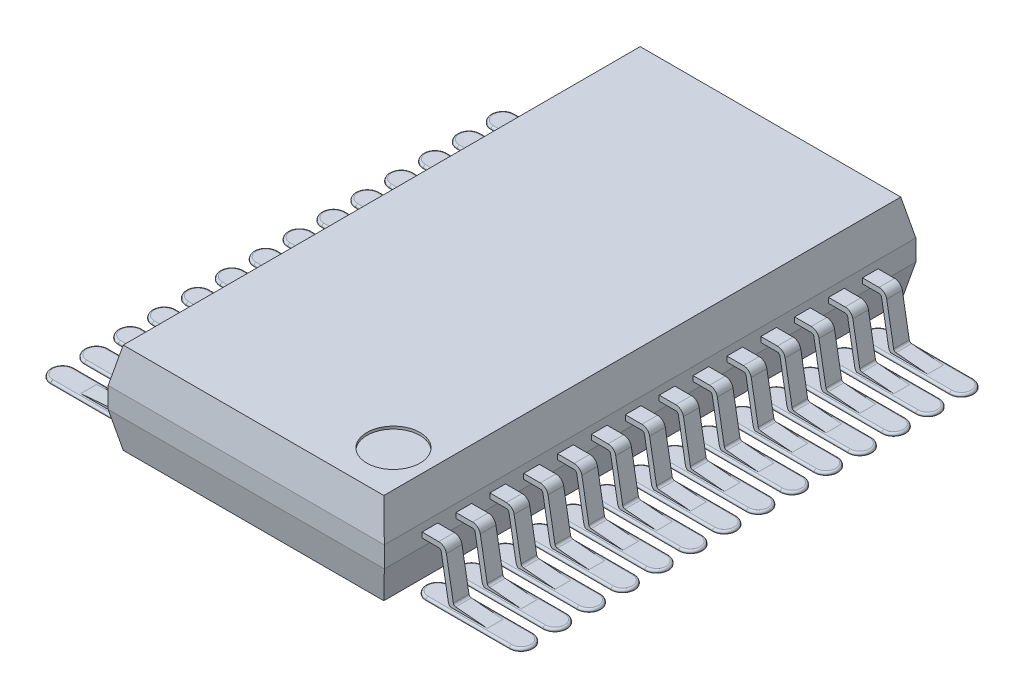
from build123d import *

# Parameters (mm, degrees)
BOSS_EXTRUDE1_DEPTH     = 5.1
CUT_EXTRUDE2_DEPTH      = 7.037797612
CUT_EXTRUDE2_DEPTH_BACK = 7.037797612
EXTRUDE_THIN1_DEPTH     = 0.15
BOSS_EXTRUDE2_DEPTH     = 0.05
FILLET1_R               = 0.04
LPATTERN1_COUNT         = 14
LPATTERN1_PITCH         = 0.65
FILLET1_OF_LPATTERN1_R  = 0.04
SKETCH3_R               = 0.51
CUT_EXTRUDE1_DEPTH      = 0.05


with BuildPart() as part:
    # Sketch1 → Boss-Extrude1 (new, symmetric)
    with BuildSketch(Plane.XY):
        Polygon((-2.5, 1.85), (2.5, 1.85), (2.65, 1.175), (2.65, 0.775), (2.5, 0.1), (-2.5, 0.1), (-2.65, 0.775), (-2.65, 1.175), align=None)
    extrude(amount=BOSS_EXTRUDE1_DEPTH, both=True)

    # Sketch4 → Cut-Extrude2 (cut, two sides: drawn at the far end of the back side and taken through both)
    with BuildSketch(Plane(origin=(0, 0, 0), x_dir=(0, 0, -1), z_dir=(1, 0, 0)).offset(-CUT_EXTRUDE2_DEPTH_BACK)):
        Polygon((-4.96, 1.85), (-5.1, 1.175), (-5.1, 0.775), (-4.96, 0.1), (-5.16, 0.1), (-5.16, 1.85), align=None)
        Polygon((5.1, 1.175), (4.96, 1.85), (5.16, 1.85), (5.16, 0.1), (4.96, 0.1), (5.1, 0.775), align=None)
    extrude(amount=CUT_EXTRUDE2_DEPTH + CUT_EXTRUDE2_DEPTH_BACK, mode=Mode.SUBTRACT)

    # Sketch2 → Extrude-Thin1 (add, symmetric)
    with BuildSketch(Plane.XY.offset(4.225)):
        with BuildLine():
            Line((-3.895642213, -0.049809735), (-3.285407414, 0.003578892))
            ThreePointArc((-3.285407414, 0.003578892), (-3.197142244, 0.042416496), (-3.150759612, 0.12696087))
            Line((-3.150759612, 0.12696087), (-3.017329188, 0.883682409))
            ThreePointArc((-3.017329188, 0.883682409), (-3.000228181, 0.913302222), (-2.968088801, 0.925))
            Line((-2.968088801, 0.925), (2.968088801, 0.925))
            ThreePointArc((2.968088801, 0.925), (3.000228181, 0.913302222), (3.017329188, 0.883682409))
            Line((3.017329188, 0.883682409), (3.150759612, 0.12696087))
            ThreePointArc((3.150759612, 0.12696087), (3.197142244, 0.042416496), (3.285407414, 0.003578892))
            Line((3.285407414, 0.003578892), (3.895642213, -0.049809735))
            Line((3.895642213, -0.049809735), (3.904357787, 0.049809735))
            Line((3.904357787, 0.049809735), (3.294122988, 0.103198362))
            ThreePointArc((3.294122988, 0.103198362), (3.264701265, 0.11614423), (3.249240388, 0.144325688))
            Line((3.249240388, 0.144325688), (3.115809963, 0.901047227))
            ThreePointArc((3.115809963, 0.901047227), (3.064506942, 0.989906666), (2.968088801, 1.025))
            Line((2.968088801, 1.025), (-2.968088801, 1.025))
            ThreePointArc((-2.968088801, 1.025), (-3.064506942, 0.989906666), (-3.115809963, 0.901047227))
            Line((-3.115809963, 0.901047227), (-3.249240388, 0.144325688))
            ThreePointArc((-3.249240388, 0.144325688), (-3.264701265, 0.11614423), (-3.294122988, 0.103198362))
            Line((-3.294122988, 0.103198362), (-3.904357787, 0.049809735))
            Line((-3.904357787, 0.049809735), (-3.895642213, -0.049809735))
        make_face()
    extrude_thin1 = extrude(amount=EXTRUDE_THIN1_DEPTH, both=True)

    # Sketch5 → Boss-Extrude2 (add)
    with BuildSketch(Plane(origin=(0, 0, 0), x_dir=(1, 0, 0), z_dir=(0, 1, 0))):
        with BuildLine():
            Line((-2.8, -4.45), (-4.4, -4.45))
            ThreePointArc((-4.4, -4.45), (-4.625, -4.225), (-4.4, -4))
            Line((-4.4, -4), (-2.8, -4))
            ThreePointArc((-2.8, -4), (-2.575, -4.225), (-2.8, -4.45))
        make_face()
        with BuildLine():
            Line((2.8, -4), (4.4, -4))
            ThreePointArc((4.4, -4), (4.625, -4.225), (4.4, -4.45))
            Line((4.4, -4.45), (2.8, -4.45))
            ThreePointArc((2.8, -4.45), (2.575, -4.225), (2.8, -4))
        make_face()
    boss_extrude2 = extrude(amount=BOSS_EXTRUDE2_DEPTH)

    # Fillet1
    fillet1_edges = [part.edges().sort_by_distance(p)[0] for p in [
        (-2.575, 0.05, 4.225),
        (-3.6, 0.05, 4),
        (-4.625, 0.05, 4.225),
        (-3.6, 0.05, 4.45),
        (2.575, 0.05, 4.225),
        (3.6, 0.05, 4.45),
        (4.625, 0.05, 4.225),
        (3.6, 0.05, 4),
    ]]
    fillet(fillet1_edges, radius=FILLET1_R)

    # LPattern1: Extrude-Thin1, Boss-Extrude2 ×14
    with Locations(*[(0, 0, -i * LPATTERN1_PITCH) for i in range(1, LPATTERN1_COUNT)]):
        add(extrude_thin1)
        add(boss_extrude2)

    # Fillet1 of LPattern1
    fillet1_of_lpattern1_edges = [part.edges().sort_by_distance(p)[0] for p in [
        (-2.575, 0.05, 3.575),
        (-3.6, 0.05, 3.35),
        (-4.625, 0.05, 3.575),
        (-3.6, 0.05, 3.8),
        (2.575, 0.05, 3.575),
        (3.6, 0.05, 3.8),
        (4.625, 0.05, 3.575),
        (3.6, 0.05, 3.35),
        (-2.575, 0.05, 2.925),
        (-3.6, 0.05, 2.7),
        (-4.625, 0.05, 2.925),
        (-3.6, 0.05, 3.15),
        (2.575, 0.05, 2.925),
        (3.6, 0.05, 3.15),
        (4.625, 0.05, 2.925),
        (3.6, 0.05, 2.7),
        (-2.575, 0.05, 2.275),
        (-3.6, 0.05, 2.05),
        (-4.625, 0.05, 2.275),
        (-3.6, 0.05, 2.5),
        (2.575, 0.05, 2.275),
        (3.6, 0.05, 2.5),
        (4.625, 0.05, 2.275),
        (3.6, 0.05, 2.05),
        (-2.575, 0.05, 1.625),
        (-3.6, 0.05, 1.4),
        (-4.625, 0.05, 1.625),
        (-3.6, 0.05, 1.85),
        (2.575, 0.05, 1.625),
        (3.6, 0.05, 1.85),
        (4.625, 0.05, 1.625),
        (3.6, 0.05, 1.4),
        (-2.575, 0.05, 0.975),
        (-3.6, 0.05, 0.75),
        (-4.625, 0.05, 0.975),
        (-3.6, 0.05, 1.2),
        (2.575, 0.05, 0.975),
        (3.6, 0.05, 1.2),
        (4.625, 0.05, 0.975),
        (3.6, 0.05, 0.75),
        (-2.575, 0.05, 0.325),
        (-3.6, 0.05, 0.1),
        (-4.625, 0.05, 0.325),
        (-3.6, 0.05, 0.55),
        (2.575, 0.05, 0.325),
        (3.6, 0.05, 0.55),
        (4.625, 0.05, 0.325),
        (3.6, 0.05, 0.1),
        (-2.575, 0.05, -0.325),
        (-3.6, 0.05, -0.55),
        (-4.625, 0.05, -0.325),
        (-3.6, 0.05, -0.1),
        (2.575, 0.05, -0.325),
        (3.6, 0.05, -0.1),
        (4.625, 0.05, -0.325),
        (3.6, 0.05, -0.55),
        (-2.575, 0.05, -0.975),
        (-3.6, 0.05, -1.2),
        (-4.625, 0.05, -0.975),
        (-3.6, 0.05, -0.75),
        (2.575, 0.05, -0.975),
        (3.6, 0.05, -0.75),
        (4.625, 0.05, -0.975),
        (3.6, 0.05, -1.2),
        (-2.575, 0.05, -1.625),
        (-3.6, 0.05, -1.85),
        (-4.625, 0.05, -1.625),
        (-3.6, 0.05, -1.4),
        (2.575, 0.05, -1.625),
        (3.6, 0.05, -1.4),
        (4.625, 0.05, -1.625),
        (3.6, 0.05, -1.85),
        (-2.575, 0.05, -2.275),
        (-3.6, 0.05, -2.5),
        (-4.625, 0.05, -2.275),
        (-3.6, 0.05, -2.05),
        (2.575, 0.05, -2.275),
        (3.6, 0.05, -2.05),
        (4.625, 0.05, -2.275),
        (3.6, 0.05, -2.5),
        (-2.575, 0.05, -2.925),
        (-3.6, 0.05, -3.15),
        (-4.625, 0.05, -2.925),
        (-3.6, 0.05, -2.7),
        (2.575, 0.05, -2.925),
        (3.6, 0.05, -2.7),
        (4.625, 0.05, -2.925),
        (3.6, 0.05, -3.15),
        (-2.575, 0.05, -3.575),
        (-3.6, 0.05, -3.8),
        (-4.625, 0.05, -3.575),
        (-3.6, 0.05, -3.35),
        (2.575, 0.05, -3.575),
        (3.6, 0.05, -3.35),
        (4.625, 0.05, -3.575),
        (3.6, 0.05, -3.8),
        (-2.575, 0.05, -4.225),
        (-3.6, 0.05, -4.45),
        (-4.625, 0.05, -4.225),
        (-3.6, 0.05, -4),
        (2.575, 0.05, -4.225),
        (3.6, 0.05, -4),
        (4.625, 0.05, -4.225),
        (3.6, 0.05, -4.45),
    ]]
    fillet(fillet1_of_lpattern1_edges, radius=FILLET1_OF_LPATTERN1_R)

    # Sketch3 → Cut-Extrude1 (cut)
    with BuildSketch(Plane(origin=(0, 1.85, 0), x_dir=(-1, 0, 0), z_dir=(0, 1, 0))):
        with Locations((-1.8, 4.075)):
            Circle(SKETCH3_R)
    extrude(amount=-CUT_EXTRUDE1_DEPTH, mode=Mode.SUBTRACT)


solid = part.part
